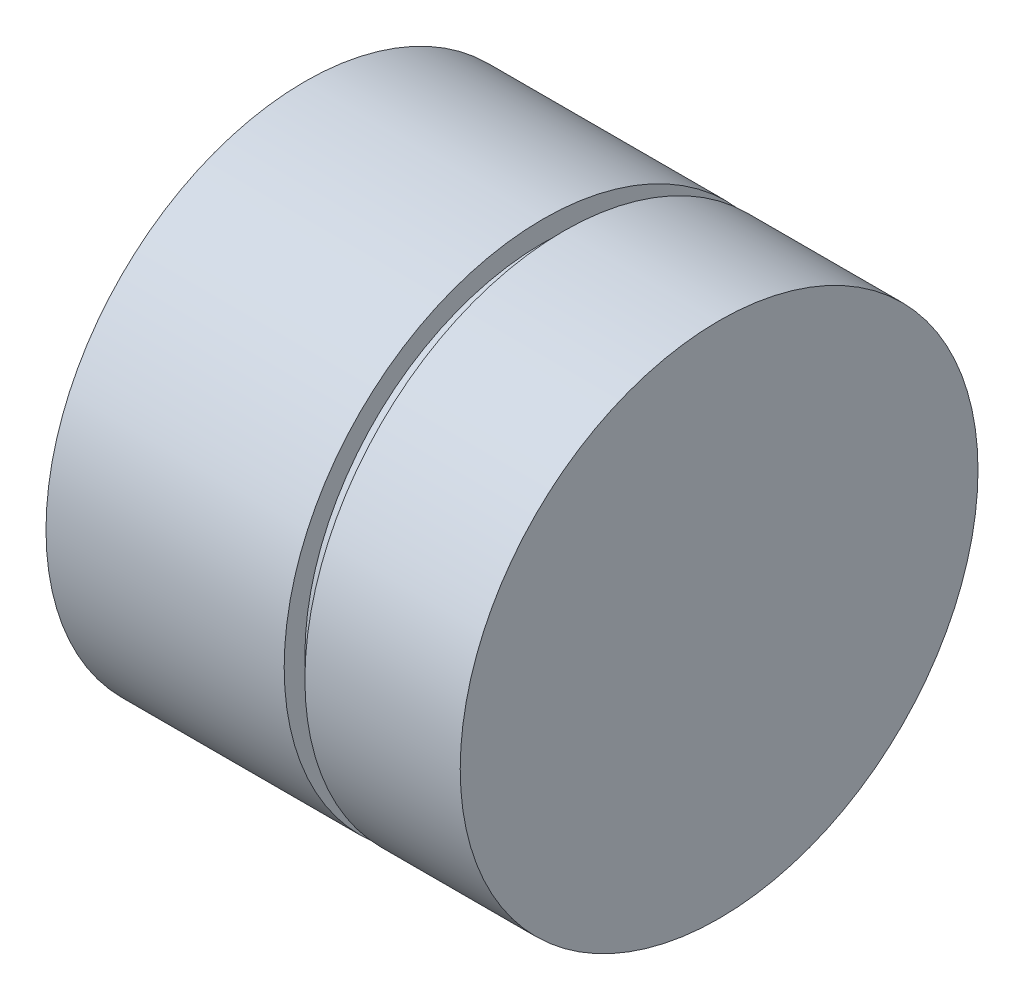
from build123d import *

# Parameters (mm, degrees)
SKETCH_1_R          = 2.5
EXTRUDE_1_DEPTH     = 2.5
SKETCH_3_R          = 2.4
EXTRUDE_4_DEPTH     = 1.5
CUT_EXTRUDE_START   = -0.2
SKETCH_4_R          = 2.5
SKETCH_4_R_2        = 2.3
CUT_EXTRUDE_2_DEPTH = 0.2
SKETCH_5_R          = 2.5
SKETCH_5_R_2        = 2.4
EXTRUDE_5_DEPTH     = 1.5
SKETCH_6_R          = 0.5
CUT_EXTRUDE_3_DEPTH = 0.4
SKETCH_7_R          = 0.15
CUT_EXTRUDE_4_DEPTH = 0.8


with BuildPart() as part:
    # 草图1 → 凸台-拉伸1 (new body)
    with BuildSketch(Plane(origin=(0, 0, 0), x_dir=(0, 0, -1), z_dir=(1, 0, 0))):
        Circle(SKETCH_1_R)
    extrude(amount=EXTRUDE_1_DEPTH)

    # 草图3 → 凸台-拉伸4 (add)
    with BuildSketch(Plane(origin=(2.5, 0, 0), x_dir=(0, 0, -1), z_dir=(1, 0, 0))):
        Circle(SKETCH_3_R)
    extrude(amount=EXTRUDE_4_DEPTH)

    # 草图4 → 切除-拉伸2 (cut)
    with BuildSketch(Plane(origin=(2.5, 0, 0), x_dir=(0, 0, -1), z_dir=(1, 0, 0)).offset(CUT_EXTRUDE_START)):
        Circle(SKETCH_4_R)
        Circle(SKETCH_4_R_2, mode=Mode.SUBTRACT)
    extrude(amount=CUT_EXTRUDE_2_DEPTH, mode=Mode.SUBTRACT)

    # 草图5 → 凸台-拉伸5 (add)
    with BuildSketch(Plane.ZY.offset(-2.5)):
        with Locations(Location((0, 0, 0), (0, 0, 180))):
            Circle(SKETCH_5_R)
        Circle(SKETCH_5_R_2, mode=Mode.SUBTRACT)
    extrude(amount=-EXTRUDE_5_DEPTH)

    # 草图6 → 切除-拉伸3 (cut)
    with BuildSketch(Plane.ZY):
        Circle(SKETCH_6_R)
    extrude(amount=-CUT_EXTRUDE_3_DEPTH, mode=Mode.SUBTRACT)

    # 草图7 → 切除-拉伸4 (cut)
    with BuildSketch(Plane.ZY):
        with Locations((0, 1)):
            Circle(SKETCH_7_R)
        with Locations((-0.866025404, -0.5)):
            Circle(SKETCH_7_R)
        with Locations((0.866025404, -0.5)):
            Circle(SKETCH_7_R)
    extrude(amount=-CUT_EXTRUDE_4_DEPTH, mode=Mode.SUBTRACT)


solid = part.part
